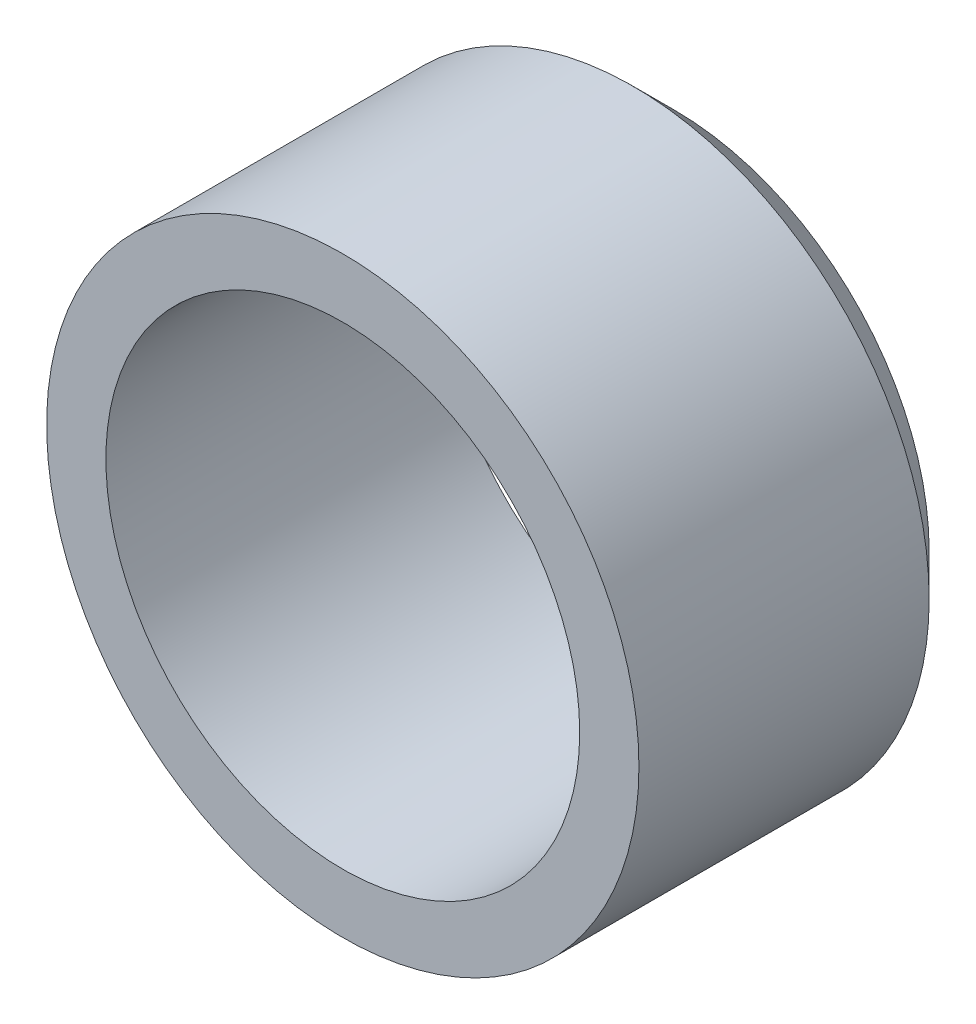
from build123d import *

# Parameters (mm, degrees)
FASE1_SIZE                      = 0.35
SKIZZE1_R                       = 2
SCHNITT_LINEAR_AUSTRAGEN1_DEPTH = 5.062019202


with BuildPart() as part:
    # Sketch1 → Revolve1 (revolve)
    with BuildSketch(Plane(origin=(0, 0, 0), x_dir=(0, 0, -1), z_dir=(1, 0, 0)), mode=Mode.PRIVATE) as revolve1_sk:
        Polygon((0, 2.5), (2.8, 2.5), (2.8, 1.5), (4, 1.5), (4, 0.5), (2, 0.5), (2, 2), (0, 2), align=None)
    revolve(revolve1_sk.sketch.rotate(Axis((0, 0, 20.700415561), (0, 0, -1)), 90), axis=Axis((0, 0, 20.700415561), (0, 0, -1)))

    # Fase1
    fase1_edges = [part.edges().sort_by_distance(p)[0] for p in [
        (-2.5, 0, -2.8),
    ]]
    chamfer(fase1_edges, length=FASE1_SIZE)

    # Skizze1 → Schnitt-Linear austragen1 (cut, through all)
    with BuildSketch(Plane.XY.offset(-2)):
        Circle(SKIZZE1_R)
    extrude(amount=-SCHNITT_LINEAR_AUSTRAGEN1_DEPTH, mode=Mode.SUBTRACT)


solid = part.part
